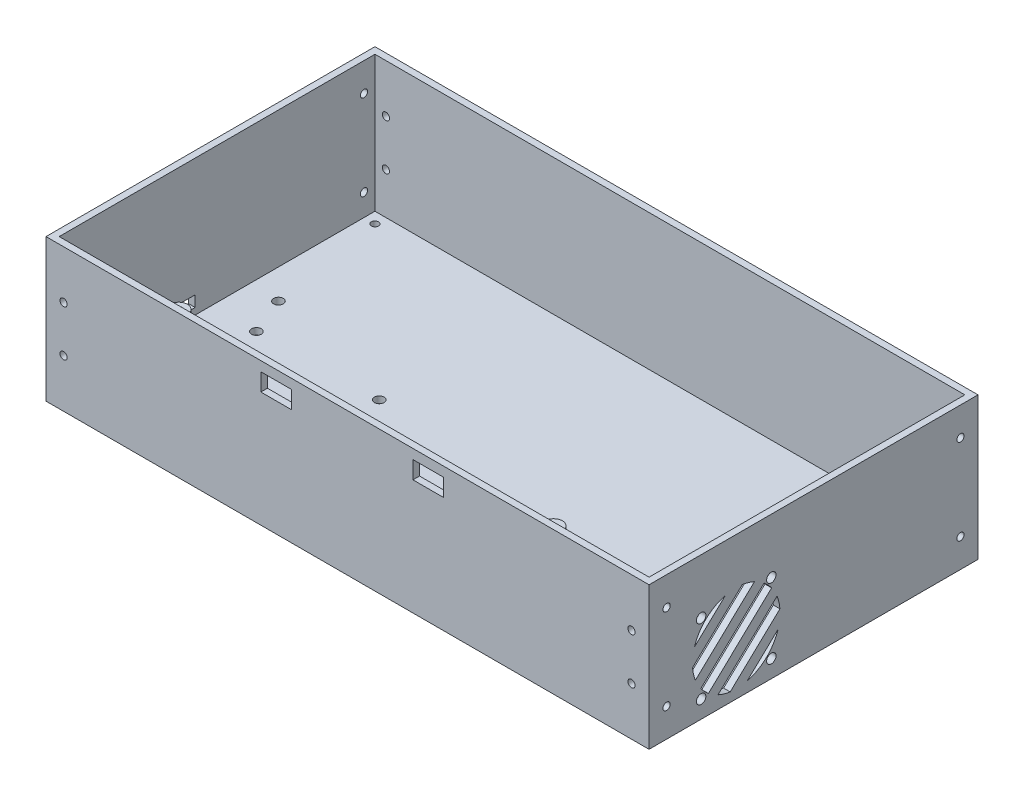
from build123d import *

# Parameters (mm, degrees)
SKIZZE1_W                        = 275
SKIZZE1_H                        = 150
AUFSATZ_LINEAR_AUSTRAGEN1_DEPTH  = 3
SKIZZE2_W                        = 3
SKIZZE2_H                        = 144
SKIZZE2_W_2                      = 269
SKIZZE2_H_2                      = 3
AUFSATZ_LINEAR_AUSTRAGEN2_DEPTH  = 62
SKIZZE3_R                        = 4
AUFSATZ_LINEAR_AUSTRAGEN3_DEPTH  = 55
SKIZZE4_R                        = 1.55
SCHNITT_LINEAR_AUSTRAGEN1_DEPTH  = 168.018711527
SKIZZE9_R                        = 1.65
SCHNITT_LINEAR_AUSTRAGEN2_DEPTH  = 169.449547343
SKIZZE8_R                        = 2.2
SCHNITT_LINEAR_AUSTRAGEN3_DEPTH  = 10
SKIZZE10_R                       = 1.65
SCHNITT_LINEAR_AUSTRAGEN4_DEPTH  = 10
SKIZZE12_R                       = 2.15
SCHNITT_LINEAR_AUSTRAGEN5_DEPTH  = 10
SKIZZE13_W                       = 50
SKIZZE13_H                       = 5
SCHNITT_LINEAR_AUSTRAGEN6_DEPTH  = 3
SKIZZE14_W                       = 14
SKIZZE14_H                       = 8
SCHNITT_LINEAR_AUSTRAGEN7_DEPTH  = 3
SKIZZE20_R                       = 1.65
SCHNITT_LINEAR_AUSTRAGEN8_DEPTH  = 3
SKIZZE21_R                       = 1.65
SCHNITT_LINEAR_AUSTRAGEN9_DEPTH  = 3
SCHNITT_LINEAR_START             = -3
SKIZZE22_R                       = 1.65
SCHNITT_LINEAR_AUSTRAGEN10_DEPTH = 3
SKIZZE23_R                       = 1.65
SCHNITT_LINEAR_AUSTRAGEN11_DEPTH = 3
SKIZZE24_R                       = 1.65
SCHNITT_LINEAR_AUSTRAGEN12_DEPTH = 3


with BuildPart() as part:
    # Skizze1 → Aufsatz-Linear austragen1 (new body)
    with BuildSketch(Plane(origin=(0, 0, 0), x_dir=(1, 0, 0), z_dir=(0, 1, 0))):
        Rectangle(SKIZZE1_W, SKIZZE1_H)
    extrude(amount=AUFSATZ_LINEAR_AUSTRAGEN1_DEPTH)

    # Skizze2 → Aufsatz-Linear austragen2 (add)
    with BuildSketch(Plane(origin=(0, 3, 0), x_dir=(1, 0, 0), z_dir=(0, 1, 0))):
        with Locations((-136, 0)):
            Rectangle(SKIZZE2_W, SKIZZE2_H)
        with Locations((0, 73.5)):
            Rectangle(SKIZZE2_W_2, SKIZZE2_H_2)
        with Locations((-136, 73.5)):
            Rectangle(SKIZZE2_W, SKIZZE2_H_2)
        with Locations((136, 0)):
            Rectangle(SKIZZE2_W, SKIZZE2_H)
        with Locations((136, 73.5)):
            Rectangle(SKIZZE2_W, SKIZZE2_H_2)
        with Locations((0, -73.5)):
            Rectangle(SKIZZE2_W_2, SKIZZE2_H_2)
        with Locations((136, -73.5)):
            Rectangle(SKIZZE2_W, SKIZZE2_H_2)
        with Locations((-136, -73.5)):
            Rectangle(SKIZZE2_W, SKIZZE2_H_2)
    extrude(amount=AUFSATZ_LINEAR_AUSTRAGEN2_DEPTH)

    # Skizze3 → Aufsatz-Linear austragen3 (add)
    with BuildSketch(Plane(origin=(0, 3, 0), x_dir=(1, 0, 0), z_dir=(0, 1, 0))):
        with Locations(Location((-85.5, -66.5, 0), (0, 0, 90))):
            Circle(SKIZZE3_R)
        with Locations(Location((85.5, -66.5, 0), (0, 0, 90))):
            Circle(SKIZZE3_R)
    extrude(amount=AUFSATZ_LINEAR_AUSTRAGEN3_DEPTH)

    # Skizze4 → Schnitt-Linear austragen1 (cut, through all)
    with BuildSketch(Plane(origin=(0, 58, 0), x_dir=(1, 0, 0), z_dir=(0, 1, 0))):
        with Locations(Location((-85.5, -66.5, 0), (0, 0, 270))):
            Circle(SKIZZE4_R)
        with Locations(Location((85.5, -66.5, 0), (0, 0, 270))):
            Circle(SKIZZE4_R)
    extrude(amount=-SCHNITT_LINEAR_AUSTRAGEN1_DEPTH, mode=Mode.SUBTRACT)

    # Skizze9 → Schnitt-Linear austragen2 (cut, through all)
    with BuildSketch(Plane(origin=(0, 3, 0), x_dir=(1, 0, 0), z_dir=(0, 1, 0))):
        with Locations(Location((85.625, -4, 0), (0, 0, 270))):
            Circle(SKIZZE9_R)
    extrude(amount=-SCHNITT_LINEAR_AUSTRAGEN2_DEPTH, mode=Mode.SUBTRACT)

    # Skizze8 → Schnitt-Linear austragen3 (cut)
    with BuildSketch(Plane(origin=(0, 3, 0), x_dir=(1, 0, 0), z_dir=(0, 1, 0))):
        with Locations(Location((121.5, 15, 0), (0, 0, 270))):
            Circle(SKIZZE8_R)
        with Locations(Location((-121, 14.5, 0), (0, 0, 270))):
            Circle(SKIZZE8_R)
        with Locations(Location((-59.042286835, -1.5, 0), (0, 0, 270))):
            Circle(SKIZZE8_R)
        with Locations(Location((-114.042286835, -2.5, 0), (0, 0, 270))):
            Circle(SKIZZE8_R)
        with Locations(Location((-113.5, -27.5, 0), (0, 0, 270))):
            Circle(SKIZZE8_R)
    extrude(amount=-SCHNITT_LINEAR_AUSTRAGEN3_DEPTH, mode=Mode.SUBTRACT)

    # Skizze10 → Schnitt-Linear austragen4 (cut)
    with BuildSketch(Plane(origin=(0, 3, 0), x_dir=(1, 0, 0), z_dir=(0, 1, 0))):
        with Locations(Location((-129.5, 67, 0), (0, 0, 270))):
            Circle(SKIZZE10_R)
        with Locations(Location((129.5, 67, 0), (0, 0, 270))):
            Circle(SKIZZE10_R)
        with Locations(Location((129.5, -67, 0), (0, 0, 270))):
            Circle(SKIZZE10_R)
        with Locations(Location((-129.5, -67, 0), (0, 0, 270))):
            Circle(SKIZZE10_R)
    extrude(amount=-SCHNITT_LINEAR_AUSTRAGEN4_DEPTH, mode=Mode.SUBTRACT)

    # Skizze12 → Schnitt-Linear austragen5 (cut)
    with BuildSketch(Plane(origin=(137.5, 0, 0), x_dir=(0, 0, -1), z_dir=(1, 0, 0))):
        with BuildLine():
            ThreePointArc((-40.238883175, 43.36778368), (-48.991660734, 38.531578038), (-54.309023109, 30.062477887))
            Line((-54.309023109, 30.062477887), (-40.238883175, 43.36778368))
        make_face()
        with BuildLine():
            ThreePointArc((-55.182247429, 22.355155802), (-54.733751685, 19.485199861), (-53.874256158, 16.710481321))
            Line((-53.874256158, 16.710481321), (-26.931989392, 42.188202207))
            ThreePointArc((-26.931989392, 42.188202207), (-29.654390681, 43.201280071), (-32.494828488, 43.809316746))
            Line((-32.494828488, 43.809316746), (-55.182247429, 22.355155802))
        make_face()
        with BuildLine():
            Line((-22.550104474, 39.450328593), (-51.385310709, 12.182565916))
            ThreePointArc((-51.385310709, 12.182565916), (-49.78291784, 10.259756223), (-47.952908231, 8.552148289))
            Line((-47.952908231, 8.552148289), (-19.116994099, 35.820580383))
            ThreePointArc((-19.116994099, 35.820580383), (-20.719761902, 37.743077559), (-22.550104474, 39.450328593))
        make_face()
        with BuildLine():
            Line((-16.627265595, 31.293405466), (-43.571806367, 5.813534186))
            ThreePointArc((-43.571806367, 5.813534186), (-40.851994747, 4.800581914), (-38.014212853, 4.191942869))
            Line((-38.014212853, 4.191942869), (-15.318505409, 25.653941765))
            ThreePointArc((-15.318505409, 25.653941765), (-15.767750872, 28.521279567), (-16.627265595, 31.293405466))
        make_face()
        with BuildLine():
            Line((-16.186522357, 17.951543986), (-30.275365538, 4.628551629))
            ThreePointArc((-30.275365538, 4.628551629), (-21.508339266, 9.468421962), (-16.186522357, 17.951543986))
        make_face()
        with Locations((-51.25, 40)):
            Circle(SKIZZE12_R)
        with BuildLine():
            ThreePointArc((-19.760186439, 42.088590385), (-20.727228529, 41.562144639), (-21.306846696, 40.626004528))
            Line((-21.306846696, 40.626004528), (-19.760186439, 42.088590385))
        make_face()
        with BuildLine():
            Line((-19.760186439, 42.088590385), (-21.306846696, 40.626004528))
            ThreePointArc((-21.306846696, 40.626004528), (-19.566448735, 37.873415838), (-17.1, 40))
            ThreePointArc((-17.1, 40), (-17.922295372, 41.691064878), (-19.760186439, 42.088590385))
        make_face()
        with Locations((-19.25, 8)):
            Circle(SKIZZE12_R)
        with BuildLine():
            ThreePointArc((-50.747386311, 5.909574331), (-49.772771471, 6.437855361), (-49.190898067, 7.381453938))
            Line((-49.190898067, 7.381453938), (-50.747386311, 5.909574331))
        make_face()
        with BuildLine():
            Line((-50.747386311, 5.909574331), (-49.190898067, 7.381453938))
            ThreePointArc((-49.190898067, 7.381453938), (-49.122845897, 7.687405338), (-49.1, 8))
            ThreePointArc((-49.1, 8), (-52.938656186, 9.330766803), (-50.747386311, 5.909574331))
        make_face()
    extrude(amount=-SCHNITT_LINEAR_AUSTRAGEN5_DEPTH, mode=Mode.SUBTRACT)

    # Skizze13 → Schnitt-Linear austragen6 (cut)
    with BuildSketch(Plane.ZY.offset(137.5)):
        with Locations((35, 8.5)):
            Rectangle(SKIZZE13_W, SKIZZE13_H)
    extrude(amount=-SCHNITT_LINEAR_AUSTRAGEN6_DEPTH, mode=Mode.SUBTRACT)

    # Skizze14 → Schnitt-Linear austragen7 (cut)
    with BuildSketch(Plane.XY.offset(75)):
        with Locations((-32.525, 56.6)):
            Rectangle(SKIZZE14_W, SKIZZE14_H)
        with Locations((36.825, 56.6)):
            Rectangle(SKIZZE14_W, SKIZZE14_H)
    extrude(amount=-SCHNITT_LINEAR_AUSTRAGEN7_DEPTH, mode=Mode.SUBTRACT)

    # Skizze20 → Schnitt-Linear austragen8 (cut)
    with BuildSketch(Plane(origin=(0, 3, 0), x_dir=(1, 0, 0), z_dir=(0, 1, 0))):
        with Locations(Location((0, -41.062589667, 0), (0, 0, 270))):
            Circle(SKIZZE20_R)
        with Locations(Location((20, -41.062589667, 0), (0, 0, 270))):
            Circle(SKIZZE20_R)
    extrude(amount=-SCHNITT_LINEAR_AUSTRAGEN8_DEPTH, mode=Mode.SUBTRACT)

    # Skizze21 → Schnitt-Linear austragen9 (cut)
    with BuildSketch(Plane(origin=(137.5, 0, 0), x_dir=(0, 0, -1), z_dir=(1, 0, 0))):
        with Locations((-67, 52)):
            Circle(SKIZZE21_R)
        with Locations((-67, 13)):
            Circle(SKIZZE21_R)
        with Locations((67, 13)):
            Circle(SKIZZE21_R)
        with Locations((67, 52)):
            Circle(SKIZZE21_R)
    extrude(amount=-SCHNITT_LINEAR_AUSTRAGEN9_DEPTH, mode=Mode.SUBTRACT)

    # Skizze22 → Schnitt-Linear austragen10 (cut)
    with BuildSketch(Plane.ZY.offset(137.5).offset(SCHNITT_LINEAR_START)):
        with Locations(Location((-67, 52, 0), (0, 0, 180))):
            Circle(SKIZZE22_R)
        with Locations(Location((-67, 13, 0), (0, 0, 180))):
            Circle(SKIZZE22_R)
        with Locations(Location((67, 13, 0), (0, 0, 180))):
            Circle(SKIZZE22_R)
        with Locations(Location((67, 52, 0), (0, 0, 180))):
            Circle(SKIZZE22_R)
    extrude(amount=SCHNITT_LINEAR_AUSTRAGEN10_DEPTH, mode=Mode.SUBTRACT)

    # Skizze23 → Schnitt-Linear austragen11 (cut)
    with BuildSketch(Plane.XY.offset(75)):
        with Locations((-129.495008006, 43)):
            Circle(SKIZZE23_R)
        with Locations((-129.5, 22)):
            Circle(SKIZZE23_R)
        with Locations((129.5, 43)):
            Circle(SKIZZE23_R)
        with Locations((129.5, 22)):
            Circle(SKIZZE23_R)
    extrude(amount=-SCHNITT_LINEAR_AUSTRAGEN11_DEPTH, mode=Mode.SUBTRACT)

    # Skizze24 → Schnitt-Linear austragen12 (cut)
    with BuildSketch(Plane(origin=(0, 0, -75), x_dir=(-1, 0, 0), z_dir=(0, 0, -1)).offset(SCHNITT_LINEAR_START)):
        with Locations(Location((-129.5, 43, 0), (0, 0, 180))):
            Circle(SKIZZE24_R)
        with Locations(Location((-129.5, 22, 0), (0, 0, 180))):
            Circle(SKIZZE24_R)
        with Locations((129.5, 43)):
            Circle(SKIZZE24_R)
        with Locations(Location((129.5, 22, 0), (0, 0, 180))):
            Circle(SKIZZE24_R)
    extrude(amount=SCHNITT_LINEAR_AUSTRAGEN12_DEPTH, mode=Mode.SUBTRACT)


solid = part.part
